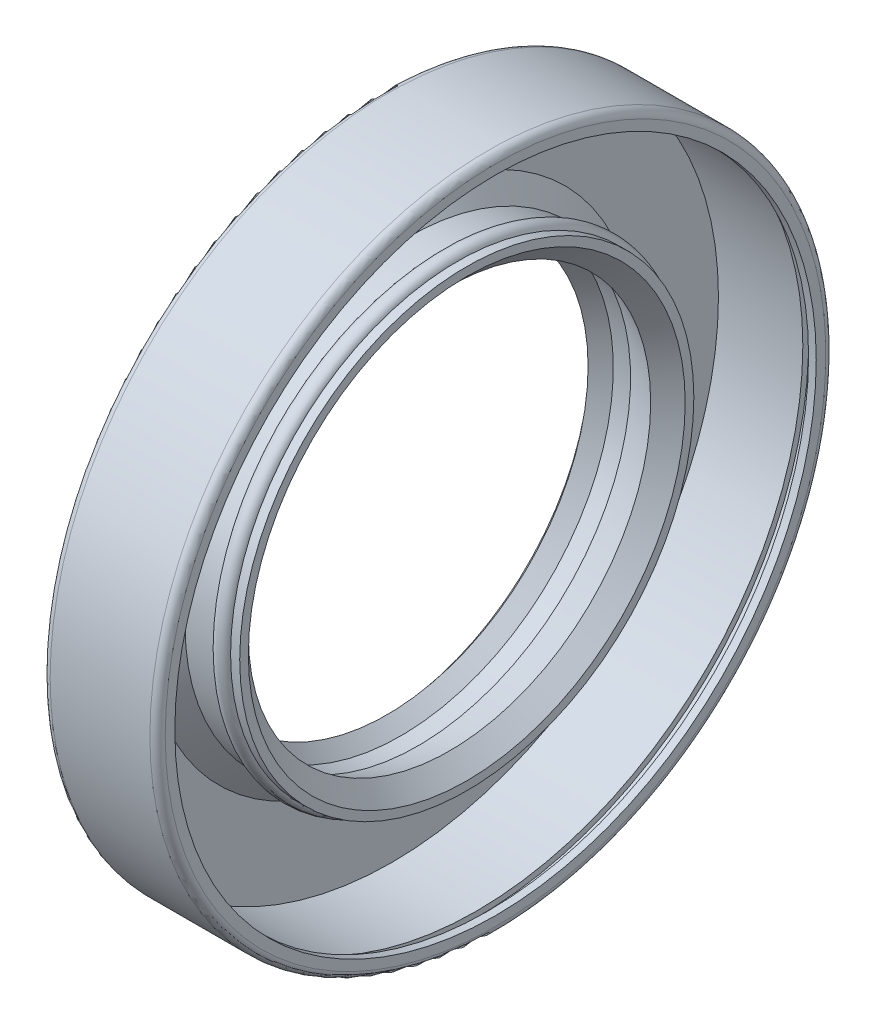
from build123d import *


with BuildPart() as part:
    # Esquisse1 → Base-Révolution (revolve)
    with BuildSketch(Plane(origin=(0, 0, 0), x_dir=(1, 0, 0), z_dir=(0, 1, 0)), mode=Mode.PRIVATE) as base_r_volution_sk:
        with BuildLine():
            Line((0, 13.5725), (0, 20.523333333))
            ThreePointArc((0, 20.523333333), (0.139612434, 20.860387566), (0.476666667, 21))
            Line((0.476666667, 21), (6.673333333, 21))
            ThreePointArc((6.673333333, 21), (7.010387566, 20.860387566), (7.15, 20.523333333))
            Line((7.15, 20.523333333), (7.15, 19.9275))
            Line((7.15, 19.9275), (6.673333333, 19.9275))
            Line((6.673333333, 19.9275), (6.673333333, 20.6425))
            Line((6.673333333, 20.6425), (5.958333333, 20.6425))
            Line((5.958333333, 20.6425), (5.958333333, 20.285))
            Line((5.958333333, 20.285), (0.715, 20.285))
            Line((0.715, 20.285), (0.715, 15.208155728))
            Line((0.715, 15.208155728), (1.7875, 13.93))
            Line((1.7875, 13.93), (3.75375, 13.93))
            ThreePointArc((3.75375, 13.93), (4.199319064, 14.458527228), (4.795581349, 14.10875))
            Line((4.795581349, 14.10875), (5.3625, 14.10875))
            Line((5.3625, 14.10875), (5.3625, 13.5725))
            Line((5.3625, 13.5725), (4.29, 12.5))
            Line((4.29, 12.5), (2.325553645, 13.215))
            Line((2.325553645, 13.215), (1.253053645, 13.215))
            Line((1.253053645, 13.215), (0.400949826, 12.5))
            Line((0.400949826, 12.5), (0, 12.977833396))
            Line((0, 12.977833396), (0.292816141, 13.223535312))
            Line((0.292816141, 13.223535312), (0, 13.5725))
        make_face()
    revolve(base_r_volution_sk.sketch.rotate(Axis((0, 0, 0), (1, 0, 0)), 180), axis=Axis((0, 0, 0), (1, 0, 0)))


solid = part.part
